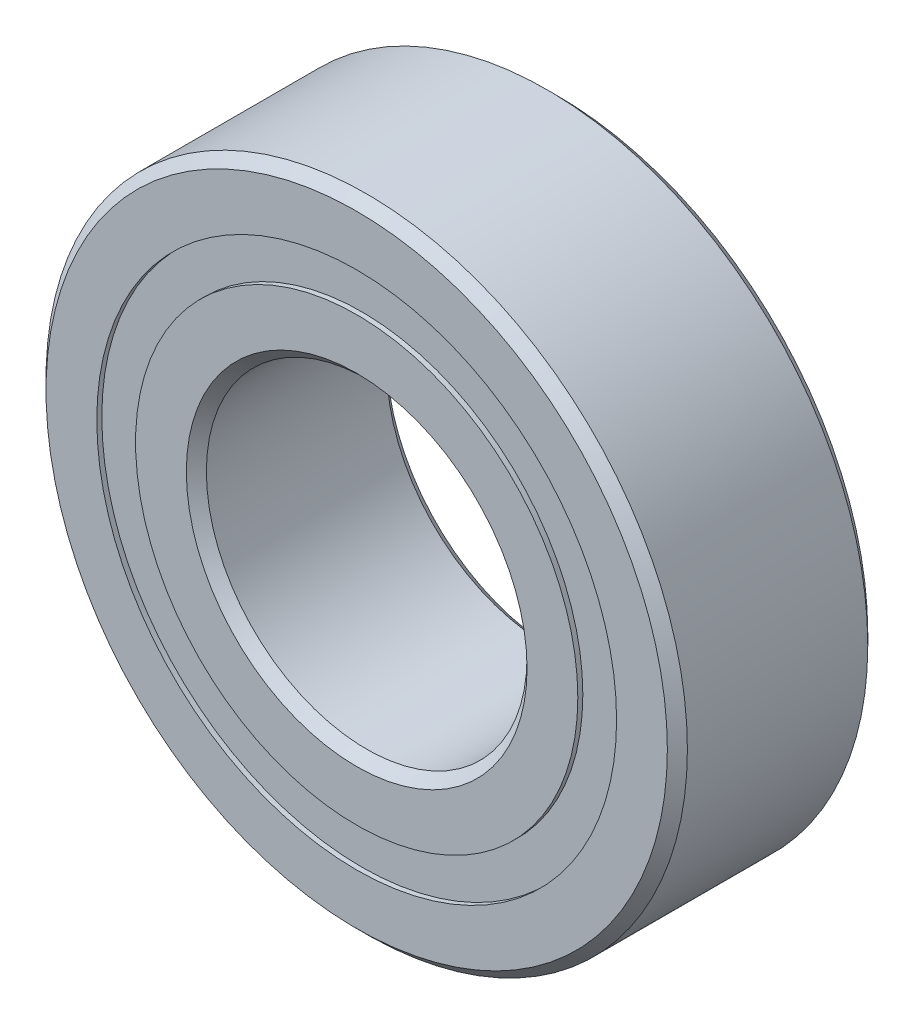
from build123d import *

# Parameters (mm, degrees)
CIRPATTERN1_COUNT = 12
SKETCH5_W         = 1.163242561
SKETCH5_H         = 0.967032968


with BuildPart() as part:
    # Sketch1 → Revolve1 (revolve)
    with BuildSketch(Plane(origin=(0, 0, 0), x_dir=(0, 0, -1), z_dir=(1, 0, 0)), mode=Mode.PRIVATE) as revolve1_sk:
        with BuildLine():
            Line((2.25, 8), (-2.25, 8))
            Line((-2.25, 8), (-2.5, 7.75))
            Line((-2.5, 7.75), (-2.5, 6.483516484))
            Line((-2.5, 6.483516484), (-1.111111111, 6.483516484))
            ThreePointArc((-1.111111111, 6.483516484), (0, 7.211757439), (1.111111111, 6.483516484))
            Line((1.111111111, 6.483516484), (2.5, 6.483516484))
            Line((2.5, 6.483516484), (2.5, 7.75))
            Line((2.5, 7.75), (2.25, 8))
        make_face()
    revolve(revolve1_sk.sketch.rotate(Axis((0, 0, 2.5), (0, 0, -1)), 90), axis=Axis((0, 0, 2.5), (0, 0, -1)))


with BuildPart() as body_2:
    # Sketch3 → Revolve3 (revolve)
    with BuildSketch(Plane(origin=(0, 0, 0), x_dir=(0, 0, -1), z_dir=(1, 0, 0)), mode=Mode.PRIVATE) as revolve3_sk:
        with BuildLine():
            Line((-2.5, 5.516483516), (-1.111111111, 5.516483516))
            ThreePointArc((-1.111111111, 5.516483516), (0, 4.788242561), (1.111111111, 5.516483516))
            Line((1.111111111, 5.516483516), (2.5, 5.516483516))
            Line((2.5, 5.516483516), (2.5, 4.25))
            Line((2.5, 4.25), (2.25, 4))
            Line((2.25, 4), (-2.25, 4))
            Line((-2.25, 4), (-2.5, 4.25))
            Line((-2.5, 4.25), (-2.5, 5.516483516))
        make_face()
    revolve(revolve3_sk.sketch.rotate(Axis((0, 0, 2.5), (0, 0, -1)), 90), axis=Axis((0, 0, 2.5), (0, 0, -1)))


with BuildPart() as body_3:
    # Sketch4 → Revolve4 (revolve)
    with BuildSketch(Plane(origin=(0, 0, 0), x_dir=(0, 0, -1), z_dir=(1, 0, 0))):
        with BuildLine():
            Line((-1.211757439, 6), (1.211757439, 6))
            ThreePointArc((1.211757439, 6), (0, 7.211757439), (-1.211757439, 6))
        make_face()
    revolve(axis=Axis((0, 6, 1.211757439), (0, 0, -1)))


with BuildPart() as cirpattern1_1:
    # CirPattern1: pattern copy
    add(body_3.part.rotate(Axis((0, 0, 0), (0, 0, 1)), 1 * 360 / CIRPATTERN1_COUNT))


with BuildPart() as cirpattern1_2:
    # CirPattern1: pattern copy
    add(body_3.part.rotate(Axis((0, 0, 0), (0, 0, 1)), 2 * 360 / CIRPATTERN1_COUNT))


with BuildPart() as cirpattern1_3:
    # CirPattern1: pattern copy
    add(body_3.part.rotate(Axis((0, 0, 0), (0, 0, 1)), 3 * 360 / CIRPATTERN1_COUNT))


with BuildPart() as cirpattern1_4:
    # CirPattern1: pattern copy
    add(body_3.part.rotate(Axis((0, 0, 0), (0, 0, 1)), 4 * 360 / CIRPATTERN1_COUNT))


with BuildPart() as cirpattern1_5:
    # CirPattern1: pattern copy
    add(body_3.part.rotate(Axis((0, 0, 0), (0, 0, 1)), 5 * 360 / CIRPATTERN1_COUNT))


with BuildPart() as cirpattern1_6:
    # CirPattern1: pattern copy
    add(body_3.part.rotate(Axis((0, 0, 0), (0, 0, 1)), 6 * 360 / CIRPATTERN1_COUNT))


with BuildPart() as cirpattern1_7:
    # CirPattern1: pattern copy
    add(body_3.part.rotate(Axis((0, 0, 0), (0, 0, 1)), 7 * 360 / CIRPATTERN1_COUNT))


with BuildPart() as cirpattern1_8:
    # CirPattern1: pattern copy
    add(body_3.part.rotate(Axis((0, 0, 0), (0, 0, 1)), 8 * 360 / CIRPATTERN1_COUNT))


with BuildPart() as cirpattern1_9:
    # CirPattern1: pattern copy
    add(body_3.part.rotate(Axis((0, 0, 0), (0, 0, 1)), 9 * 360 / CIRPATTERN1_COUNT))


with BuildPart() as cirpattern1_10:
    # CirPattern1: pattern copy
    add(body_3.part.rotate(Axis((0, 0, 0), (0, 0, 1)), 10 * 360 / CIRPATTERN1_COUNT))


with BuildPart() as cirpattern1_11:
    # CirPattern1: pattern copy
    add(body_3.part.rotate(Axis((0, 0, 0), (0, 0, 1)), 11 * 360 / CIRPATTERN1_COUNT))


with BuildPart() as body_15:
    # Sketch5 → Revolve5 (revolve)
    with BuildSketch(Plane(origin=(0, 0, 0), x_dir=(0, 0, -1), z_dir=(1, 0, 0)), mode=Mode.PRIVATE) as revolve5_sk:
        with Locations((-1.79337872, 6)):
            Rectangle(SKETCH5_W, SKETCH5_H)
        with Locations((1.79337872, 6)):
            Rectangle(SKETCH5_W, SKETCH5_H)
    revolve(revolve5_sk.sketch.rotate(Axis((0, 0, 2.5), (0, 0, -1)), 90), axis=Axis((0, 0, 2.5), (0, 0, -1)))


solid = Compound([part.part, body_2.part, body_3.part, cirpattern1_1.part, cirpattern1_2.part, cirpattern1_3.part, cirpattern1_4.part, cirpattern1_5.part, cirpattern1_6.part, cirpattern1_7.part, cirpattern1_8.part, cirpattern1_9.part, cirpattern1_10.part, cirpattern1_11.part, body_15.part])
